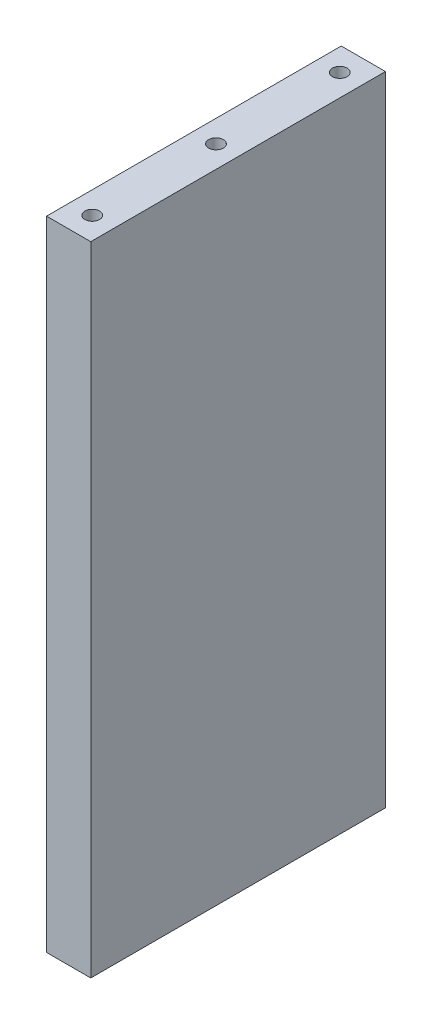
from build123d import *

# Parameters (mm, degrees)
SKETCH1_W           = 9.525
SKETCH1_H           = 137.414
BOSS_EXTRUDE1_DEPTH = 63.5
SKETCH2_R           = 1.5875
CUT_EXTRUDE1_DEPTH  = 9.525


with BuildPart() as part:
    # Sketch1 → Boss-Extrude1 (new body)
    with BuildSketch(Plane.XY):
        Rectangle(SKETCH1_W, SKETCH1_H)
    extrude(amount=BOSS_EXTRUDE1_DEPTH)

    # Sketch2 → Cut-Extrude1 (cut)
    with BuildSketch(Plane(origin=(0, 68.707, 0), x_dir=(1, 0, 0), z_dir=(0, 1, 0))):
        with Locations(Location((0, -5.08, 0), (0, 0, 270))):
            Circle(SKETCH2_R)
        with Locations(Location((0, -31.75, 0), (0, 0, 270))):
            Circle(SKETCH2_R)
        with Locations(Location((0, -58.42, 0), (0, 0, 270))):
            Circle(SKETCH2_R)
    cut_extrude1 = extrude(amount=-CUT_EXTRUDE1_DEPTH, mode=Mode.SUBTRACT)

    # Mirror1: Cut-Extrude1 across plane
    add(cut_extrude1.mirror(Plane.ZX), mode=Mode.SUBTRACT)


solid = part.part
